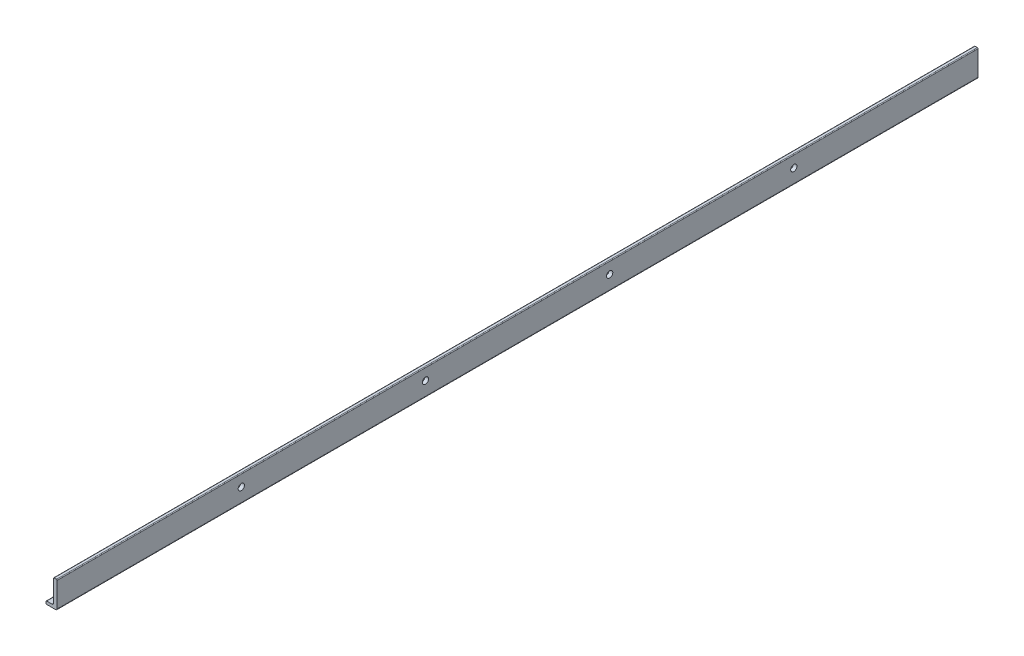
from build123d import *

# Parameters (mm, degrees)
EXTRUDE_1_DEPTH    = 620
HOLE_WIZARD_M5_1_D = 4.2
FILLET_1_R         = 1
FILLET_2_R         = 0.5


with BuildPart() as part:
    # 草图1 → 凸台-拉伸1 (new body)
    with BuildSketch(Plane.XY):
        Polygon((0, 0), (0, 18), (-2.5, 18), (-2.5, 2), (-7.5, 2), (-7.5, 0), align=None)
    extrude(amount=EXTRUDE_1_DEPTH)

    # M5 螺纹孔1 (through all)
    with Locations(Plane(origin=(0, 0, 0), x_dir=(0, 0, -1), z_dir=(1, 0, 0))):
        with Locations((-496, 10), (-372, 10), (-248, 10), (-124, 10)):
            Hole(HOLE_WIZARD_M5_1_D / 2)

    # 圆角1
    fillet_1_edges = [part.edges().sort_by_distance(p)[0] for p in [
        (-2.5, 2, 310),
        (0, 0, 310),
    ]]
    fillet(fillet_1_edges, radius=FILLET_1_R)

    # 圆角2
    fillet_2_edges = [part.edges().sort_by_distance(p)[0] for p in [
        (-7.5, 0, 310),
        (-7.5, 2, 310),
        (-2.5, 18, 310),
        (0, 18, 310),
    ]]
    fillet(fillet_2_edges, radius=FILLET_2_R)


solid = part.part
